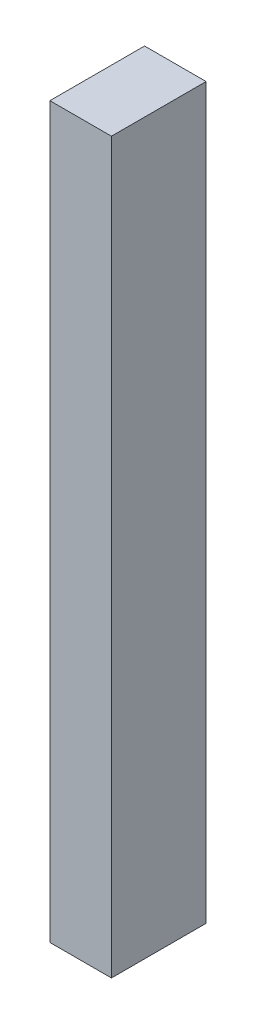
from build123d import *

# Parameters (mm, degrees)
CROQUIS1_W              = 6.5
CROQUIS1_H              = 10
SALIENTE_EXTRUIR1_DEPTH = 77


with BuildPart() as part:
    # Croquis1 → Saliente-Extruir1 (new body)
    with BuildSketch(Plane(origin=(0, 0, 0), x_dir=(1, 0, 0), z_dir=(0, 1, 0))):
        Rectangle(CROQUIS1_W, CROQUIS1_H)
    extrude(amount=SALIENTE_EXTRUIR1_DEPTH)


solid = part.part
